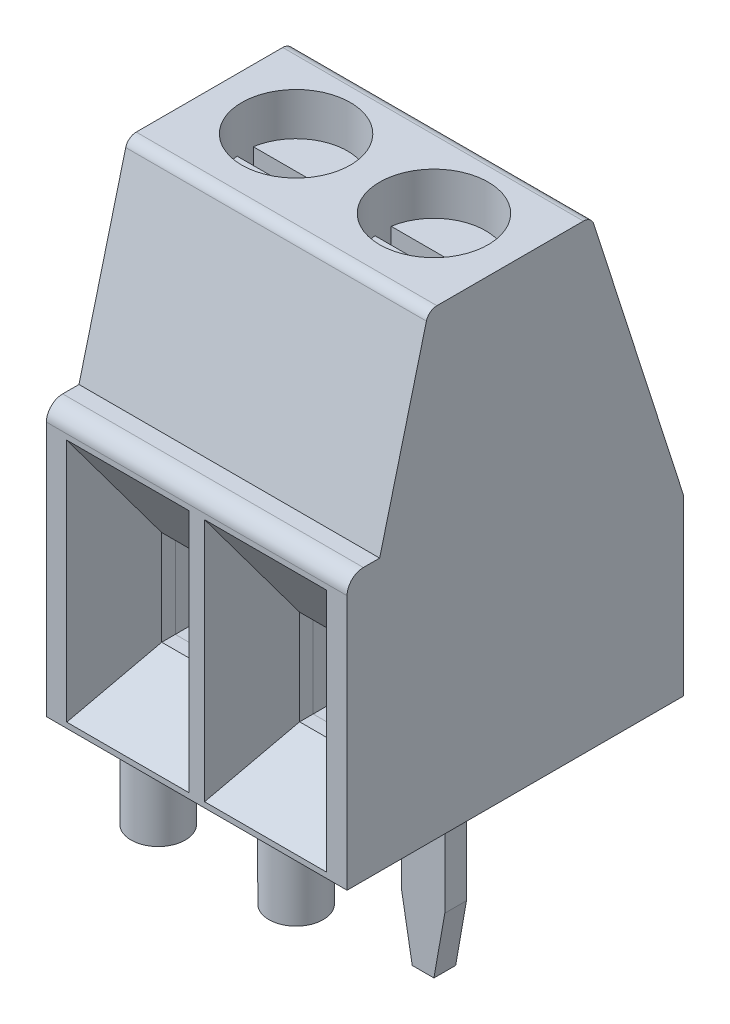
from build123d import *
from OCP.BRepFilletAPI import BRepFilletAPI_MakeChamfer

# Parameters (mm, degrees)
EXTRUSION2_DEPTH                                   = 2.77
ESQUISSE5_W                                        = 2
ESQUISSE5_H                                        = 3.25
EXTRUSION3_DEPTH                                   = 6.5
CHAMBRAGE_POUR_VIS_T_TE_HEXAGONALE_M31_D           = 1.5
CHAMBRAGE_POUR_VIS_T_TE_HEXAGONALE_M31_CBORE_D     = 2
CHAMBRAGE_POUR_VIS_T_TE_HEXAGONALE_M31_CBORE_DEPTH = 1.5
EXTRUSION4_REACH                                   = 12.219
ESQUISSE8_2_W                                      = 1.25
ESQUISSE8_2_H                                      = 1.75
CHANFREIN1_SIZE                                    = 0.5
CHANFREIN1_SIZE2                                   = 0.181985117
EXTRUSION5_DEPTH                                   = 0.5
CHANFREIN4_SIZE                                    = 0.5
CHANFREIN4_SIZE2                                   = 0.181985117
EXTRUSION6_DEPTH                                   = 0.5
ESQUISSE11_R                                       = 0.5
EXTRUSION7_DEPTH                                   = 1.25
EXTRUSION8_DEPTH                                   = 0.4
CHANFREIN5_SIZE                                    = 0.2
CHANFREIN5_SIZE2                                   = 1.134256364
ESQUISSE13_W                                       = 2
ESQUISSE13_H                                       = 4.2
ESQUISSE13_W_2                                     = 1.25
ESQUISSE13_H_2                                     = 2.7
EXTRUSION9_DEPTH                                   = 3
ESQUISSE16_R                                       = 0.95
EXTRUSION10_DEPTH                                  = 0.75
ESQUISSE17_W                                       = 1.9
ESQUISSE17_H                                       = 0.3
EXTRUSION11_DEPTH                                  = 0.3
ESQUISSE18_R                                       = 0.7
EXTRUSION12_DEPTH                                  = 3.3
R_P_TITION_LIN_AIRE1_COUNT                         = 2
R_P_TITION_LIN_AIRE1_PITCH                         = 2.54


with BuildPart() as part:
    # Esquisse4 → Extrusion2 (new body)
    with BuildSketch(Plane(origin=(0, 0, 0), x_dir=(0, 0, -1), z_dir=(1, 0, 0))):
        with BuildLine():
            Line((-3.1, 0), (3.1, 0))
            Line((3.1, 0), (3.1, 3.2))
            Line((3.1, 3.2), (1.444557478, 8.361085511))
            ThreePointArc((1.444557478, 8.361085511), (1.371976405, 8.461581407), (1.254114414, 8.5))
            Line((1.254114414, 8.5), (-1.44492216, 8.5))
            ThreePointArc((-1.44492216, 8.5), (-1.567474921, 8.458053221), (-1.638620747, 8.349808208))
            Line((-1.638620747, 8.349808208), (-2.5, 5))
            Line((-2.5, 5), (-2.8, 5))
            ThreePointArc((-2.8, 5), (-3.012132034, 4.912132034), (-3.1, 4.7))
            Line((-3.1, 4.7), (-3.1, 0))
        make_face()
    extrude(amount=EXTRUSION2_DEPTH)

    # Esquisse5 → Extrusion3 (cut)
    with BuildSketch(Plane.XZ):
        with Locations((1.5, -0.025)):
            Rectangle(ESQUISSE5_W, ESQUISSE5_H)
    extrude(amount=-EXTRUSION3_DEPTH, mode=Mode.SUBTRACT)

    # Chambrage pour vis à tête hexagonale M31 (through all)
    with Locations(Plane(origin=(1.5, 8.5, 0), x_dir=(0, 0, 1), z_dir=(0, 1, 0))):
        with Locations((0, 0)):
            CounterBoreHole(CHAMBRAGE_POUR_VIS_T_TE_HEXAGONALE_M31_D / 2, CHAMBRAGE_POUR_VIS_T_TE_HEXAGONALE_M31_CBORE_D / 2, CHAMBRAGE_POUR_VIS_T_TE_HEXAGONALE_M31_CBORE_DEPTH)

    # Esquisse7 → Enlèvement de matière-Lissage1 section 0
    with BuildSketch(Plane.XY.offset(3.1)):
        with BuildLine():
            Line((0.375, 4.6), (2.625, 4.6))
            Line((2.625, 4.6), (2.625, 0.1))
            Line((2.625, 0.1), (0.375, 0.1))
            Line((0.375, 0.1), (0.375, 4.6))
        make_face()
    # Esquisse8 → Enlèvement de matière-Lissage1 section 1
    with BuildSketch(Plane(origin=(0, 0, 1.85), x_dir=(-1, 0, 0), z_dir=(0, 0, -1))):
        with BuildLine():
            Line((-0.875, 2.75), (-2.125, 2.75))
            Line((-2.125, 2.75), (-2.125, 1))
            Line((-2.125, 1), (-0.875, 1))
            Line((-0.875, 1), (-0.875, 2.75))
        make_face()
    loft(mode=Mode.SUBTRACT)

    # Esquisse8<2> → Extrusion4 (cut, up to next)
    with BuildSketch(Plane(origin=(0, 0, 1.85), x_dir=(-1, 0, 0), z_dir=(0, 0, -1)), mode=Mode.PRIVATE) as extrusion4_sk1:
        with Locations((-1.5, 1.875)):
            Rectangle(ESQUISSE8_2_W, ESQUISSE8_2_H)
    extrusion4_tool1 = extrude(extrusion4_sk1.sketch, amount=EXTRUSION4_REACH, mode=Mode.PRIVATE) & part.part
    add(extrusion4_tool1.solids().sort_by_distance((1.5, 1.875, 1.85))[0], mode=Mode.SUBTRACT)

    # Chanfrein1
    chanfrein1_edges = [part.edges().sort_by_distance(p)[0] for p in [
        (1.5, 0, 1.6),
    ]]
    chanfrein1_side = [part.faces().sort_by_distance(p)[0] for p in [
        (1.5, 3.528179191, 1.6),
    ]]
    chamfer(chanfrein1_edges, length=CHANFREIN1_SIZE, length2=CHANFREIN1_SIZE2, reference=chanfrein1_side[0])

    # Esquisse9 → Extrusion5 (cut, symmetric)
    with BuildSketch(Plane.ZY.offset(-1.5)):
        with BuildLine():
            Line((-1.65, 0), (-2.55, 0))
            Line((-2.55, 0), (-2.55, 3.35))
            ThreePointArc((-2.55, 3.35), (-2.432842712, 3.632842712), (-2.15, 3.75))
            Line((-2.15, 3.75), (-2.05, 3.75))
            Line((-2.05, 3.75), (-2.05, 4.25))
            Line((-2.05, 4.25), (-1.65, 5.75))
            Line((-1.65, 5.75), (-1.65, 0))
        make_face()
    extrude(amount=EXTRUSION5_DEPTH, both=True, mode=Mode.SUBTRACT)

    # Chanfrein4: one chamfer whose edges measure the first distance from different faces: ONE call of the kernel's chamfer builder (chamfer() names one face for all edges)
    chanfrein4_edges_1 = [part.edges().sort_by_distance(p)[0] for p in [
        (0.75, 0, -1.65),
        (2.25, 0, -1.65),
    ]]
    chanfrein4_side_1 = [part.faces().sort_by_distance(p)[0] for p in [
        (2.25, 0.068007353, -1.65),
    ]]
    chanfrein4_edges_2 = [part.edges().sort_by_distance(p)[0] for p in [
        (1.5, 0, -2.55),
    ]]
    chanfrein4_side_2 = [part.faces().sort_by_distance(p)[0] for p in [
        (1.5, 1.675, -2.55),
    ]]
    chanfrein4 = BRepFilletAPI_MakeChamfer(part.part.solid().wrapped)
    for e in chanfrein4_edges_1:
        chanfrein4.Add(CHANFREIN4_SIZE, CHANFREIN4_SIZE2, e.wrapped, chanfrein4_side_1[0].wrapped)  # the first distance lies on this face
    for e in chanfrein4_edges_2:
        chanfrein4.Add(CHANFREIN4_SIZE, CHANFREIN4_SIZE2, e.wrapped, chanfrein4_side_2[0].wrapped)  # the first distance lies on this face
    add(Compound.cast(chanfrein4.Shape()), mode=Mode.REPLACE)

    # Esquisse10 → Extrusion6 (cut, symmetric)
    with BuildSketch(Plane.ZY.offset(-1.5)):
        Polygon((-2.55, 2.5), (-2.9, 1.25), (-3.1, 1.25), (-3.1, 3.2), (-2.55, 4.914705882), align=None)
    extrude(amount=EXTRUSION6_DEPTH, both=True, mode=Mode.SUBTRACT)

    # Esquisse11 → Extrusion7 (add)
    with BuildSketch(Plane.XZ):
        with Locations((1.5, 2.54)):
            Circle(ESQUISSE11_R)
    extrude(amount=EXTRUSION7_DEPTH)

    # Symétrie1: part across plane


with BuildPart() as part_1:
    add(part.part)
    add(part.part.mirror(Plane(origin=(2.77, 8.3, -1.254114414), x_dir=(0, 0, 1), z_dir=(1, 0, 0))))


with BuildPart() as body_2:
    # Esquisse12 → Extrusion8 (new, symmetric)
    with BuildSketch(Plane.ZY.offset(-1.5)):
        with BuildLine():
            Line((-0.2, -3.5), (0.2, -3.5))
            Line((0.2, -3.5), (0.2, 0))
            ThreePointArc((0.2, 0), (0.053553391, 0.353553391), (-0.3, 0.5))
            Line((-0.3, 0.5), (-2.05, 0.5))
            ThreePointArc((-2.05, 0.5), (-2.120710678, 0.529289322), (-2.15, 0.6))
            Line((-2.15, 0.6), (-2.15, 3.05))
            ThreePointArc((-2.15, 3.05), (-2.120710678, 3.120710678), (-2.05, 3.15))
            Line((-2.05, 3.15), (1.6, 3.15))
            Line((1.6, 3.15), (1.6, 3.55))
            Line((1.6, 3.55), (-2.05, 3.55))
            ThreePointArc((-2.05, 3.55), (-2.403553391, 3.403553391), (-2.55, 3.05))
            Line((-2.55, 3.05), (-2.55, 0.6))
            ThreePointArc((-2.55, 0.6), (-2.403553391, 0.246446609), (-2.05, 0.1))
            Line((-2.05, 0.1), (-0.3, 0.1))
            ThreePointArc((-0.3, 0.1), (-0.229289322, 0.070710678), (-0.2, 0))
            Line((-0.2, 0), (-0.2, -3.5))
        make_face()
    extrude(amount=EXTRUSION8_DEPTH, both=True)

    # Chanfrein5
    chanfrein5_edges = [body_2.edges().sort_by_distance(p)[0] for p in [
        (1.9, -3.5, 0),
        (1.1, -3.5, 0),
    ]]
    chanfrein5_side = [body_2.faces().sort_by_distance(p)[0] for p in [
        (1.5, -3.5, 0),
    ]]
    chamfer(chanfrein5_edges, length=CHANFREIN5_SIZE, length2=CHANFREIN5_SIZE2, reference=chanfrein5_side[0])


with BuildPart() as body_3:
    # Esquisse13 → Extrusion9 (new body)
    with BuildSketch(Plane(origin=(0, 0, 1.6), x_dir=(-1, 0, 0), z_dir=(0, 0, -1))):
        with Locations((-1.5, 2.6)):
            Rectangle(ESQUISSE13_W, ESQUISSE13_H)
        with Locations((-1.5, 2.35)):
            Rectangle(ESQUISSE13_W_2, ESQUISSE13_H_2, mode=Mode.SUBTRACT)
    extrude(amount=EXTRUSION9_DEPTH)

    # Esquisse14 → Trou taraudé M1.61 (revolve, cut)
    with BuildSketch(Plane(origin=(1.5, 4.7, 0), x_dir=(0, 0, 1), z_dir=(1, 0, 0))):
        Polygon((0, 0), (0, 3.425537887), (0.625, 3.05), (0.625, 0), align=None)
    revolve(axis=Axis((1.5, 11.05, 0), (0, -1, 0)), mode=Mode.SUBTRACT)


with BuildPart() as body_4:
    # Esquisse16 → Extrusion10 (new body)
    with BuildSketch(Plane(origin=(0, 7, 0), x_dir=(1, 0, 0), z_dir=(0, 1, 0))):
        with Locations((1.5, 0)):
            Circle(ESQUISSE16_R)
    extrude(amount=EXTRUSION10_DEPTH)

    # Esquisse17 → Extrusion11 (cut)
    with BuildSketch(Plane(origin=(0, 7.75, 0), x_dir=(1, 0, 0), z_dir=(0, 1, 0))):
        with Locations((1.5, 0)):
            Rectangle(ESQUISSE17_W, ESQUISSE17_H)
    extrude(amount=-EXTRUSION11_DEPTH, mode=Mode.SUBTRACT)

    # Esquisse18 → Extrusion12 (add)
    with BuildSketch(Plane.XZ.offset(-7)):
        with Locations((1.5, 0)):
            Circle(ESQUISSE18_R)
    extrude(amount=EXTRUSION12_DEPTH)


with BuildPart() as r_p_tition_lin_aire1_1:
    # Répétition linéaire1: pattern copy
    add(body_4.part.moved(Location(Vector(1, 0, 0) * (1 * R_P_TITION_LIN_AIRE1_PITCH))))


with BuildPart() as r_p_tition_lin_aire1_2:
    # Répétition linéaire1: pattern copy
    add(body_3.part.moved(Location(Vector(1, 0, 0) * (1 * R_P_TITION_LIN_AIRE1_PITCH))))


with BuildPart() as r_p_tition_lin_aire1_3:
    # Répétition linéaire1: pattern copy
    add(body_2.part.moved(Location(Vector(1, 0, 0) * (1 * R_P_TITION_LIN_AIRE1_PITCH))))


solid = Compound([part_1.part, body_2.part, body_3.part, body_4.part, r_p_tition_lin_aire1_1.part, r_p_tition_lin_aire1_2.part, r_p_tition_lin_aire1_3.part])
